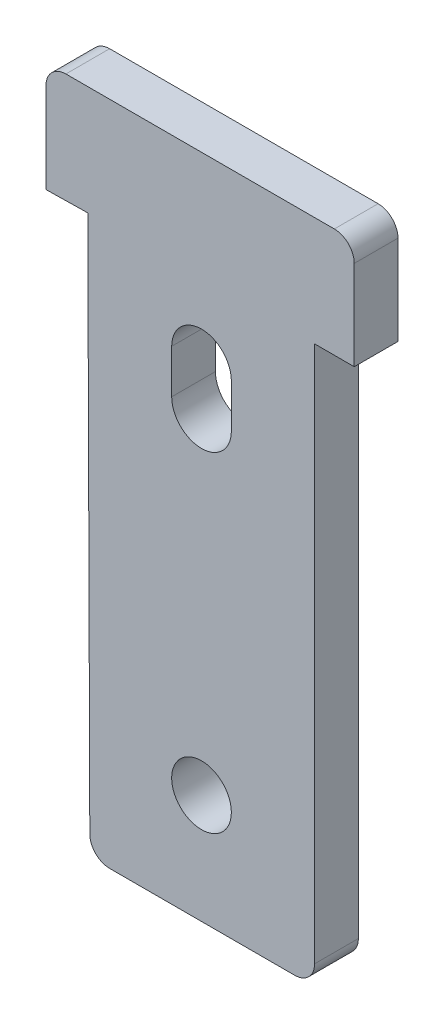
from build123d import *

# Parameters (mm, degrees)
SKETCH1_R           = 1.5
BOSS_EXTRUDE1_DEPTH = 2.2


with BuildPart() as part:
    # Sketch1 → Boss-Extrude1 (new body)
    with BuildSketch(Plane.XY):
        with BuildLine():
            Line((-4.547445363, -16.75), (4.756345477, -16.75))
            ThreePointArc((4.756345477, -16.75), (5.463452258, -16.457106781), (5.756345477, -15.75))
            Line((5.756345477, -15.75), (5.756345477, 11.25))
            Line((5.756345477, 11.25), (7.75, 11.25))
            Line((7.75, 11.25), (7.75, 15.75))
            ThreePointArc((7.75, 15.75), (7.457106781, 16.457106781), (6.75, 16.75))
            Line((6.75, 16.75), (-6.75, 16.75))
            ThreePointArc((-6.75, 16.75), (-7.457106781, 16.457106781), (-7.75, 15.75))
            Line((-7.75, 15.75), (-7.75, 11.213631532))
            Line((-7.75, 11.213631532), (-5.65, 11.25))
            Line((-5.65, 11.25), (-5.547438151, -15.753798025))
            ThreePointArc((-5.547438151, -15.753798025), (-5.253208062, -16.458448313), (-4.547445363, -16.75))
        make_face()
        with Locations((0.070153023, -11.25)):
            Circle(SKETCH1_R, mode=Mode.SUBTRACT)
        with BuildLine():
            Line((-1.429846977, 5.35), (-1.429846977, 7.55))
            ThreePointArc((-1.429846977, 7.55), (0.070153023, 9.05), (1.570153023, 7.55))
            Line((1.570153023, 7.55), (1.570153023, 5.35))
            ThreePointArc((1.570153023, 5.35), (0.070153023, 3.85), (-1.429846977, 5.35))
        make_face(mode=Mode.SUBTRACT)
    extrude(amount=BOSS_EXTRUDE1_DEPTH)


solid = part.part
